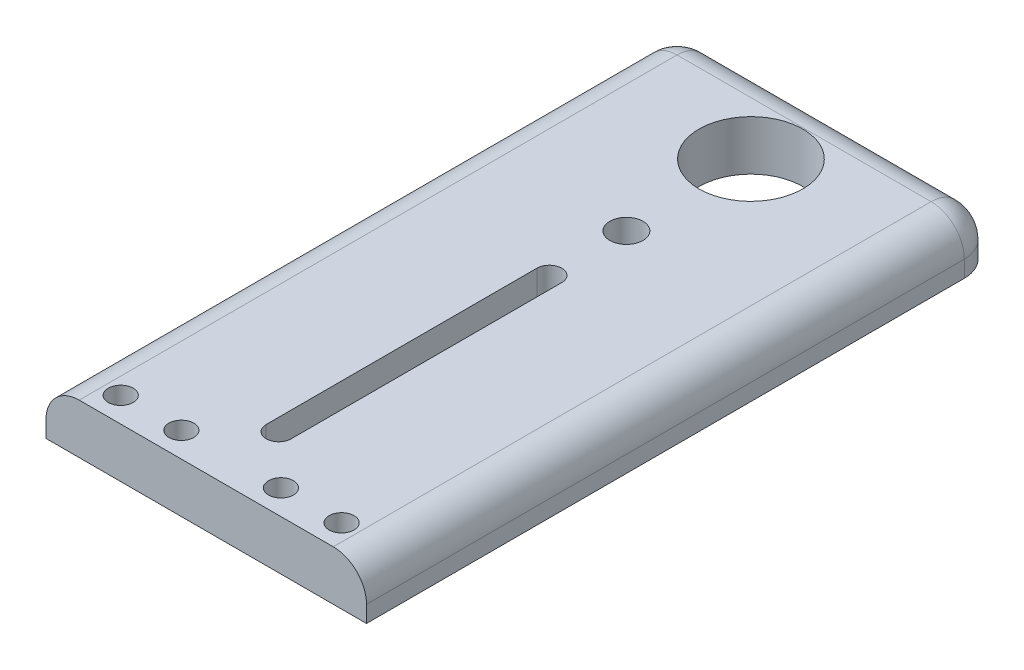
from build123d import *

# Parameters (mm, degrees)
SKETCH1_W           = 49.022
SKETCH1_H           = 96.52
BOSS_EXTRUDE1_DEPTH = 7.62
SKETCH2_R           = 1.905
CUT_EXTRUDE1_DEPTH  = 55.661514075
SKETCH3_R           = 7.9375
CUT_EXTRUDE2_DEPTH  = 55.661514075
FILLET1_R           = 5.08
FILLET2_R           = 5.08
CUT_EXTRUDE3_DEPTH  = 55.661514075
SKETCH5_R           = 7.9375
SKETCH5_R_2         = 2.54
CUT_EXTRUDE4_DEPTH  = 55.661514075


with BuildPart() as part:
    # Sketch1 → Boss-Extrude1 (new body)
    with BuildSketch(Plane(origin=(0, 0, 0), x_dir=(1, 0, 0), z_dir=(0, 1, 0))):
        Rectangle(SKETCH1_W, SKETCH1_H)
    extrude(amount=BOSS_EXTRUDE1_DEPTH)

    # Sketch2 → Cut-Extrude1 (cut, through all)
    with BuildSketch(Plane(origin=(0, 7.62, 0), x_dir=(1, 0, 0), z_dir=(0, 1, 0))):
        with Locations(Location((-16.891, -44.45, 0), (0, 0, 270))):
            Circle(SKETCH2_R)
        with Locations(Location((-7.62, -44.45, 0), (0, 0, 270))):
            Circle(SKETCH2_R)
        with Locations(Location((7.62, -44.45, 0), (0, 0, 270))):
            Circle(SKETCH2_R)
        with Locations(Location((16.891, -44.45, 0), (0, 0, 270))):
            Circle(SKETCH2_R)
    extrude(amount=-CUT_EXTRUDE1_DEPTH, mode=Mode.SUBTRACT)

    # Sketch3 → Cut-Extrude2 (cut, through all)
    with BuildSketch(Plane(origin=(0, 7.62, 0), x_dir=(1, 0, 0), z_dir=(0, 1, 0))):
        with Locations(Location((0, 35.052, 0), (0, 0, 270))):
            Circle(SKETCH3_R)
    extrude(amount=-CUT_EXTRUDE2_DEPTH, mode=Mode.SUBTRACT)

    # Fillet1
    fillet1_edges = [part.edges().sort_by_distance(p)[0] for p in [
        (-24.511, 3.81, -48.26),
        (24.511, 3.81, -48.26),
    ]]
    fillet(fillet1_edges, radius=FILLET1_R)

    # Fillet2
    fillet2_edges = [part.edges().sort_by_distance(p)[0] for p in [
        (24.511, 7.62, 2.54),
        (-24.511, 7.62, 2.54),
        (0, 7.62, -48.26),
        (23.023102448, 7.62, -46.772102448),
        (-23.023102448, 7.62, -46.772102448),
    ]]
    fillet(fillet2_edges, radius=FILLET2_R)

    # Sketch4 → Cut-Extrude3 (cut, through all)
    with BuildSketch(Plane(origin=(0, 7.62, 0), x_dir=(1, 0, 0), z_dir=(0, 1, 0))):
        with BuildLine():
            Line((-1.905, -34.645821142), (-1.905, -37.185821142))
            ThreePointArc((-1.905, -37.185821142), (0, -39.090821142), (1.905, -37.185821142))
            Line((1.905, -37.185821142), (1.905, -34.645821142))
            Line((1.905, -34.645821142), (1.905, 4.217007536))
            ThreePointArc((1.905, 4.217007536), (0, 6.122007536), (-1.905, 4.217007536))
            Line((-1.905, 4.217007536), (-1.905, -34.645821142))
        make_face()
    extrude(amount=-CUT_EXTRUDE3_DEPTH, mode=Mode.SUBTRACT)

    # Sketch5 → Cut-Extrude4 (cut, through all)
    with BuildSketch(Plane(origin=(0, 7.62, 0), x_dir=(1, 0, 0), z_dir=(0, 1, 0))):
        with Locations(Location((0, 35.052, 0), (0, 0, 270))):
            Circle(SKETCH5_R)
        with Locations(Location((0, 16.002, 0), (0, 0, 270))):
            Circle(SKETCH5_R_2)
    extrude(amount=-CUT_EXTRUDE4_DEPTH, mode=Mode.SUBTRACT)


solid = part.part
